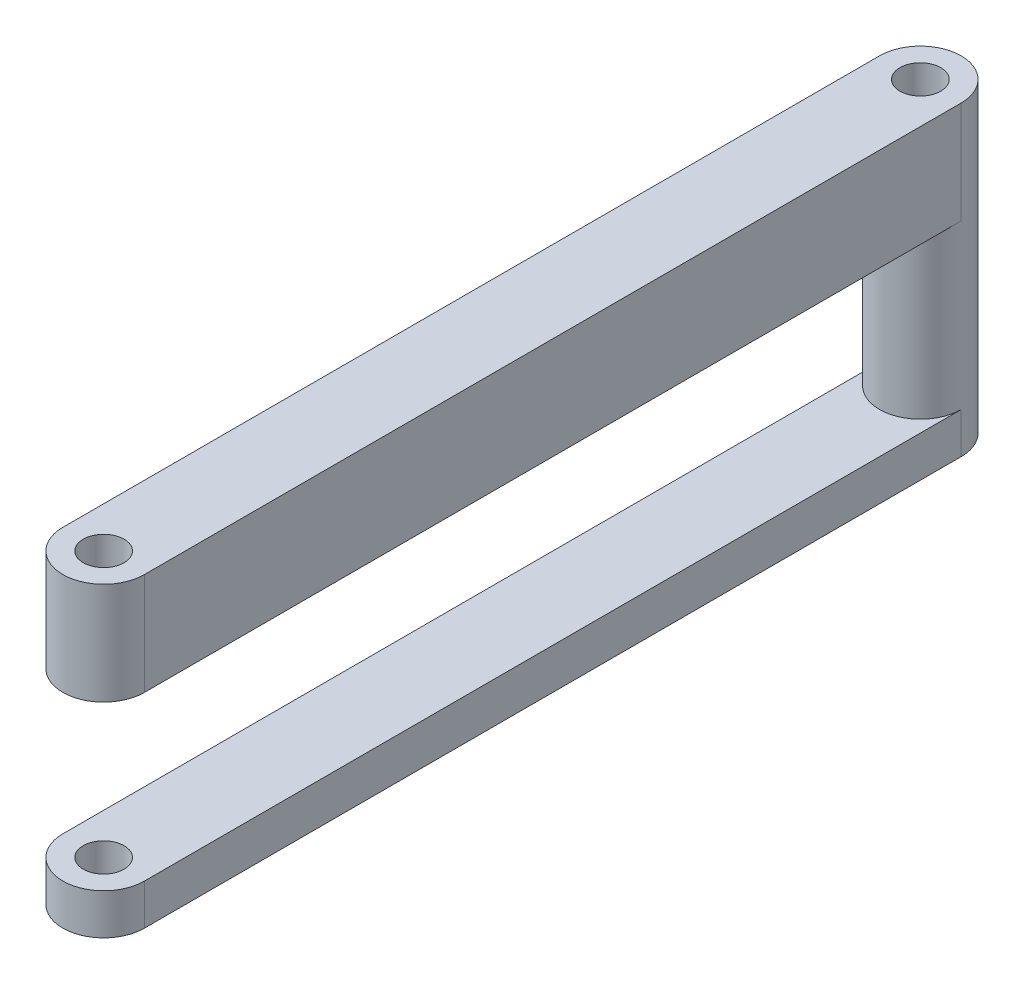
from build123d import *
from build123d.topology import SkipClean

# Parameters (mm, degrees)
BOSS_EXTRUDE1_DEPTH             = 2
SKETCH2_R                       = 2
BOSS_EXTRUDE2_DEPTH             = 12
BOSS_EXTRUDE3_START             = 10
BOSS_EXTRUDE3_DEPTH             = 5
F_2_0MM_CLEARANCE_DOWEL_HOLE1_D = 2


with BuildPart() as part:
    # Sketch1 → Boss-Extrude1 (new body)
    with BuildSketch(Plane(origin=(0, 0, 0), x_dir=(1, 0, 0), z_dir=(0, 1, 0))):
        with BuildLine():
            Line((2, 0), (2, -40))
            ThreePointArc((2, -40), (0, -42), (-2, -40))
            Line((-2, -40), (-2, 0))
            ThreePointArc((-2, 0), (0, 2), (2, 0))
        make_face()
    extrude(amount=BOSS_EXTRUDE1_DEPTH)

    # Sketch2 → Boss-Extrude2 (add)
    with SkipClean():  # the faces are left unmerged after this step: merging them gives an invalid solid
        with BuildSketch(Plane(origin=(0, 2, 0), x_dir=(1, 0, 0), z_dir=(0, 1, 0))):
            Circle(SKETCH2_R)
        extrude(amount=BOSS_EXTRUDE2_DEPTH)
    add(part.part.scale(1), mode=Mode.REPLACE)  # the faces are merged on a copy

    # Sketch1<3> → Boss-Extrude3 (add)
    with BuildSketch(Plane(origin=(0, 0, 0), x_dir=(1, 0, 0), z_dir=(0, 1, 0)).offset(BOSS_EXTRUDE3_START)):
        with BuildLine():
            Line((2, 0), (2, -40))
            ThreePointArc((2, -40), (0, -42), (-2, -40))
            Line((-2, -40), (-2, 0))
            ThreePointArc((-2, 0), (0, 2), (2, 0))
        make_face()
    extrude(amount=BOSS_EXTRUDE3_DEPTH)

    # Ø2.0mm Clearance Dowel Hole1 (through all)
    with Locations(Plane(origin=(0, 15, 0), x_dir=(1, 0, 0), z_dir=(0, 1, 0))):
        with Locations((0, 0), (0, -40)):
            Hole(F_2_0MM_CLEARANCE_DOWEL_HOLE1_D / 2)


solid = part.part
